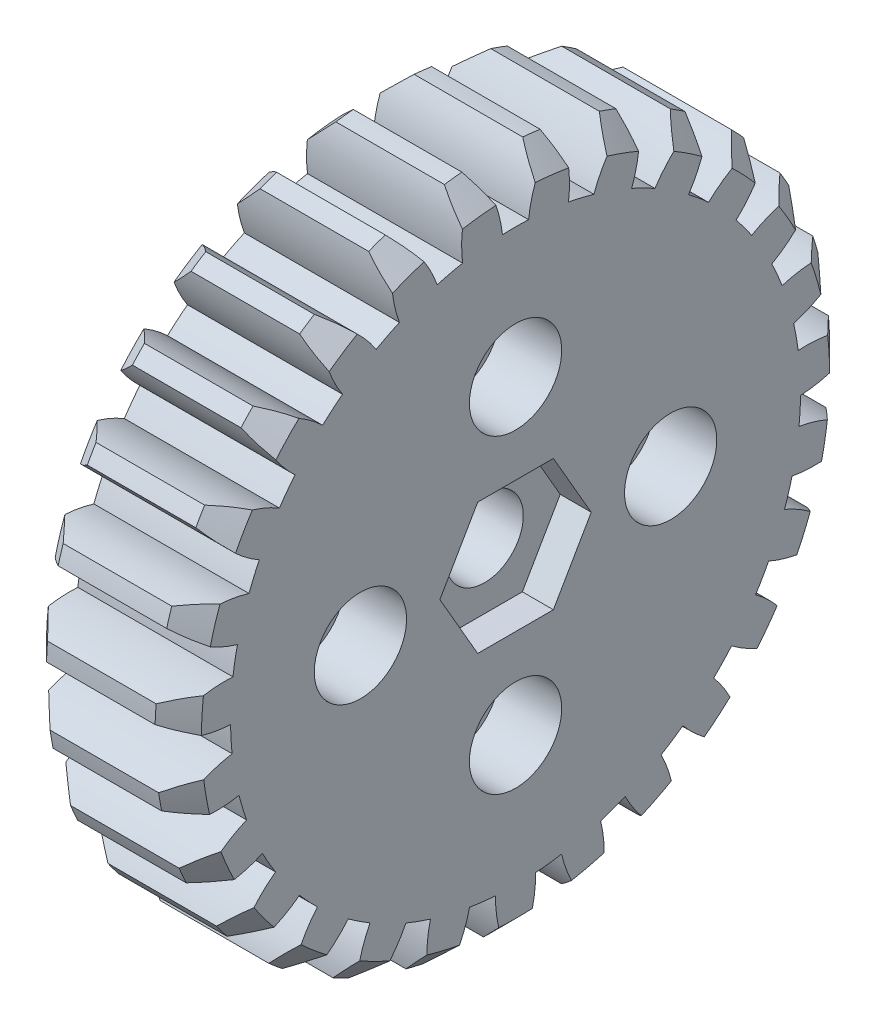
from build123d import *

# Parameters (mm, degrees)
BASPROSKE_W        = 10
BASPROSKE_H        = 21.75
TOOTHCUT_DEPTH     = 33.343855676
TEETHCUTS_COUNT    = 27
TEETHCUTS_ANGLE    = 346.666666667
BORSKE_R           = 2.5
BORE_DEPTH         = 50.0000508
CUT_EXTRUDE1_DEPTH = 2
SKETCH4_R          = 1.725
CUT_EXTRUDE2_DEPTH = 33.336320909
SKETCH6_R          = 2.975
CUT_EXTRUDE3_DEPTH = 4
CHAMFER1_SIZE      = 1.5


with BuildPart() as part:
    # BasProSke → Base-Revolve (revolve)
    with BuildSketch(Plane(origin=(0, 0, 0), x_dir=(1, 0, 0), z_dir=(0, 1, 0))):
        with Locations((5, 10.875)):
            Rectangle(BASPROSKE_W, BASPROSKE_H)
    revolve(axis=Axis((-10, 0, 0), (1, 0, 0)))

    # TooCutSke → ToothCut (cut, through all)
    with BuildSketch(Plane(origin=(0, 0, 0), x_dir=(0, 0, -1), z_dir=(1, 0, 0))):
        with BuildLine():
            ThreePointArc((0.841527813, 18.354718928), (0, 18.374), (-0.841527813, 18.354718928))
            ThreePointArc((-0.841527813, 18.354718928), (-1.225506385, 20.082481154), (-1.975588404, 21.685596501))
            ThreePointArc((-1.975588404, 21.685596501), (0, 21.7754), (1.975588404, 21.685596501))
            ThreePointArc((1.975588404, 21.685596501), (1.225506385, 20.082481154), (0.841527813, 18.354718928))
        make_face()
    toothcut = extrude(amount=TOOTHCUT_DEPTH, mode=Mode.SUBTRACT)

    # TeethCuts: ToothCut ×27 about axis
    teethcuts_axis = Axis((-10, 0, 0), (1, 0, 0))
    for i in range(1, TEETHCUTS_COUNT):
        add(toothcut.rotate(teethcuts_axis, i * TEETHCUTS_ANGLE / (TEETHCUTS_COUNT - 1)), mode=Mode.SUBTRACT)

    # BorSke → Bore (cut, symmetric)
    with BuildSketch(Plane(origin=(0, 0, 0), x_dir=(0, 0, -1), z_dir=(1, 0, 0))):
        Circle(BORSKE_R)
    extrude(amount=BORE_DEPTH, both=True, mode=Mode.SUBTRACT)

    # Sketch2 → Cut-Extrude1 (cut)
    with BuildSketch(Plane(origin=(10, 0, -10), x_dir=(0, 0, 1), z_dir=(-1, 0, 0))):
        Polygon((14.878609775, 0), (12.439304887, 4.225), (7.560695113, 4.225), (5.121390225, 0), (7.560695113, -4.225), (12.439304887, -4.225), align=None)
    extrude(amount=CUT_EXTRUDE1_DEPTH, mode=Mode.SUBTRACT)

    # Sketch4 → Cut-Extrude2 (cut, through all)
    with BuildSketch(Plane(origin=(10, 0, 0), x_dir=(0, 0, -1), z_dir=(1, 0, 0))):
        with Locations((0, 10)):
            Circle(SKETCH4_R)
        with Locations((10, 0)):
            Circle(SKETCH4_R)
        with Locations((0, -10)):
            Circle(SKETCH4_R)
        with Locations((-10, 0)):
            Circle(SKETCH4_R)
    extrude(amount=-CUT_EXTRUDE2_DEPTH, mode=Mode.SUBTRACT)

    # Sketch6 → Cut-Extrude3 (cut)
    with BuildSketch(Plane.ZY.offset(-10)):
        with Locations((0, -10)):
            Circle(SKETCH6_R)
        with Locations((10, 0)):
            Circle(SKETCH6_R)
        with Locations((0, 10)):
            Circle(SKETCH6_R)
        with Locations((-10, 0)):
            Circle(SKETCH6_R)
    extrude(amount=CUT_EXTRUDE3_DEPTH, mode=Mode.SUBTRACT)

    # Chamfer1
    chamfer1_edges = [part.edges().sort_by_distance(p)[0] for p in [
        (0, -21.163725935, -5.015895189),
        (0, -21.75, 0),
        (0, -21.163725935, 5.015895189),
        (0, -19.436509927, 9.761382169),
        (0, -19.436509927, -9.761382169),
        (0, -16.661466638, -13.980630511),
        (0, -12.98819937, -17.446179442),
        (0, -8.614734911, -19.971200325),
        (0, -3.776847864, -21.419568628),
        (0, 1.264650029, -21.713202442),
        (0, 6.237970311, -20.836271893),
        (0, 10.875, -18.836052532),
        (0, 14.925755624, -15.820376704),
        (0, 18.171859898, -11.951820273),
        (0, 20.438314502, -7.438938117),
        (0, 21.602934281, -2.525020882),
        (0, 21.602934281, 2.525020882),
        (0, 20.438314502, 7.438938117),
        (0, 18.171859898, 11.951820273),
        (0, 14.925755624, 15.820376704),
        (0, 10.875, 18.836052532),
        (0, 6.237970311, 20.836271893),
        (0, 1.264650029, 21.713202442),
        (0, -3.776847864, 21.419568628),
        (0, -8.614734911, 19.971200325),
        (0, -12.98819937, 17.446179442),
        (0, -16.661466638, 13.980630511),
        (10, -3.776847864, -21.419568628),
        (10, -8.614734911, -19.971200325),
        (10, -12.98819937, -17.446179442),
        (10, -16.661466638, -13.980630511),
        (10, -19.436509927, -9.761382169),
        (10, -21.163725935, -5.015895189),
        (10, -21.75, 0),
        (10, -21.163725935, 5.015895189),
        (10, -19.436509927, 9.761382169),
        (10, -16.661466638, 13.980630511),
        (10, -12.98819937, 17.446179442),
        (10, -8.614734911, 19.971200325),
        (10, -3.776847864, 21.419568628),
        (10, 1.264650029, 21.713202442),
        (10, 6.237970311, 20.836271893),
        (10, 10.875, 18.836052532),
        (10, 14.925755624, 15.820376704),
        (10, 18.171859898, 11.951820273),
        (10, 20.438314502, 7.438938117),
        (10, 21.602934281, 2.525020882),
        (10, 21.602934281, -2.525020882),
        (10, 20.438314502, -7.438938117),
        (10, 18.171859898, -11.951820273),
        (10, 14.925755624, -15.820376704),
        (10, 10.875, -18.836052532),
        (10, 6.237970311, -20.836271893),
        (10, 1.264650029, -21.713202442),
    ]]
    chamfer(chamfer1_edges, length=CHAMFER1_SIZE)


solid = part.part
